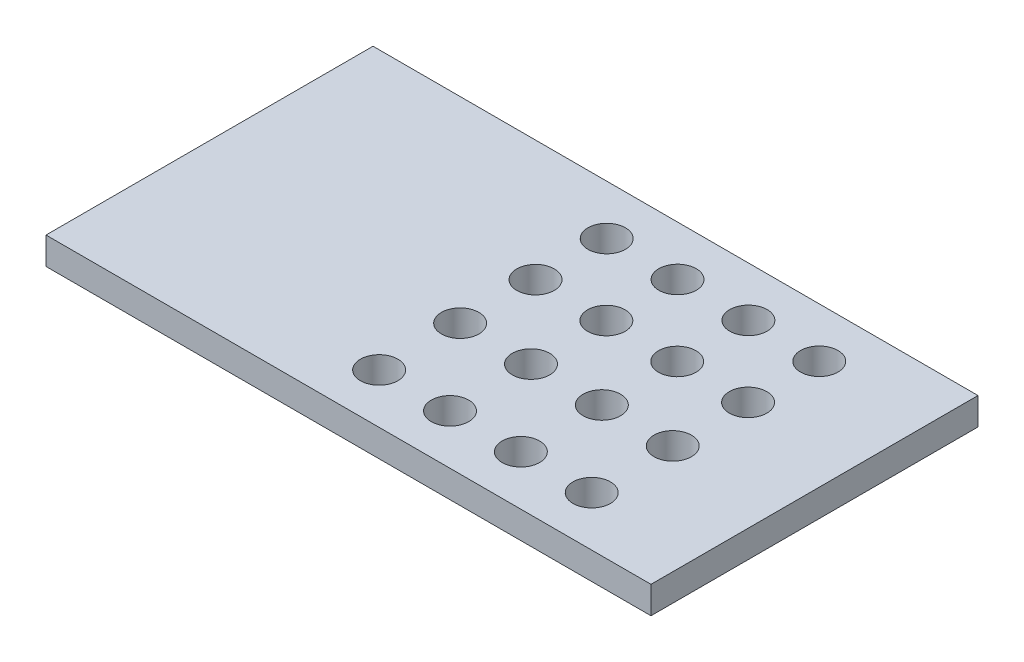
from build123d import *

# Parameters (mm, degrees)
SKETCH1_W           = 140.97
SKETCH1_H           = 76.2
SKETCH1_R           = 4.365625
BOSS_EXTRUDE1_DEPTH = 6.35


with BuildPart() as part:
    # Sketch1 → Boss-Extrude1 (new body)
    with BuildSketch(Plane(origin=(0, 0, 0), x_dir=(1, 0, 0), z_dir=(0, 1, 0))):
        with Locations((-20.32, -1.14427)):
            Rectangle(SKETCH1_W, SKETCH1_H)
        with Locations(Location((-24.765, 25.36698, 0), (0, 0, 270))):
            Circle(SKETCH1_R, mode=Mode.SUBTRACT)
        with Locations(Location((-8.255, 25.36698, 0), (0, 0, 270))):
            Circle(SKETCH1_R, mode=Mode.SUBTRACT)
        with Locations(Location((8.255, 25.36698, 0), (0, 0, 270))):
            Circle(SKETCH1_R, mode=Mode.SUBTRACT)
        with Locations(Location((24.765, 25.36698, 0), (0, 0, 270))):
            Circle(SKETCH1_R, mode=Mode.SUBTRACT)
        with Locations(Location((24.765, 8.78078, 0), (0, 0, 270))):
            Circle(SKETCH1_R, mode=Mode.SUBTRACT)
        with Locations(Location((8.255, 8.78078, 0), (0, 0, 270))):
            Circle(SKETCH1_R, mode=Mode.SUBTRACT)
        with Locations(Location((-8.255, 8.78078, 0), (0, 0, 270))):
            Circle(SKETCH1_R, mode=Mode.SUBTRACT)
        with Locations(Location((-24.765, 8.78078, 0), (0, 0, 270))):
            Circle(SKETCH1_R, mode=Mode.SUBTRACT)
        with Locations(Location((-24.765, -8.78078, 0), (0, 0, 270))):
            Circle(SKETCH1_R, mode=Mode.SUBTRACT)
        with Locations(Location((-8.255, -8.78078, 0), (0, 0, 270))):
            Circle(SKETCH1_R, mode=Mode.SUBTRACT)
        with Locations(Location((8.255, -8.78078, 0), (0, 0, 270))):
            Circle(SKETCH1_R, mode=Mode.SUBTRACT)
        with Locations(Location((24.765, -8.78078, 0), (0, 0, 270))):
            Circle(SKETCH1_R, mode=Mode.SUBTRACT)
        with Locations(Location((24.765, -27.65552, 0), (0, 0, 270))):
            Circle(SKETCH1_R, mode=Mode.SUBTRACT)
        with Locations(Location((8.255, -27.65552, 0), (0, 0, 270))):
            Circle(SKETCH1_R, mode=Mode.SUBTRACT)
        with Locations(Location((-8.255, -27.65552, 0), (0, 0, 270))):
            Circle(SKETCH1_R, mode=Mode.SUBTRACT)
        with Locations(Location((-24.765, -27.65552, 0), (0, 0, 270))):
            Circle(SKETCH1_R, mode=Mode.SUBTRACT)
    extrude(amount=BOSS_EXTRUDE1_DEPTH)


solid = part.part
